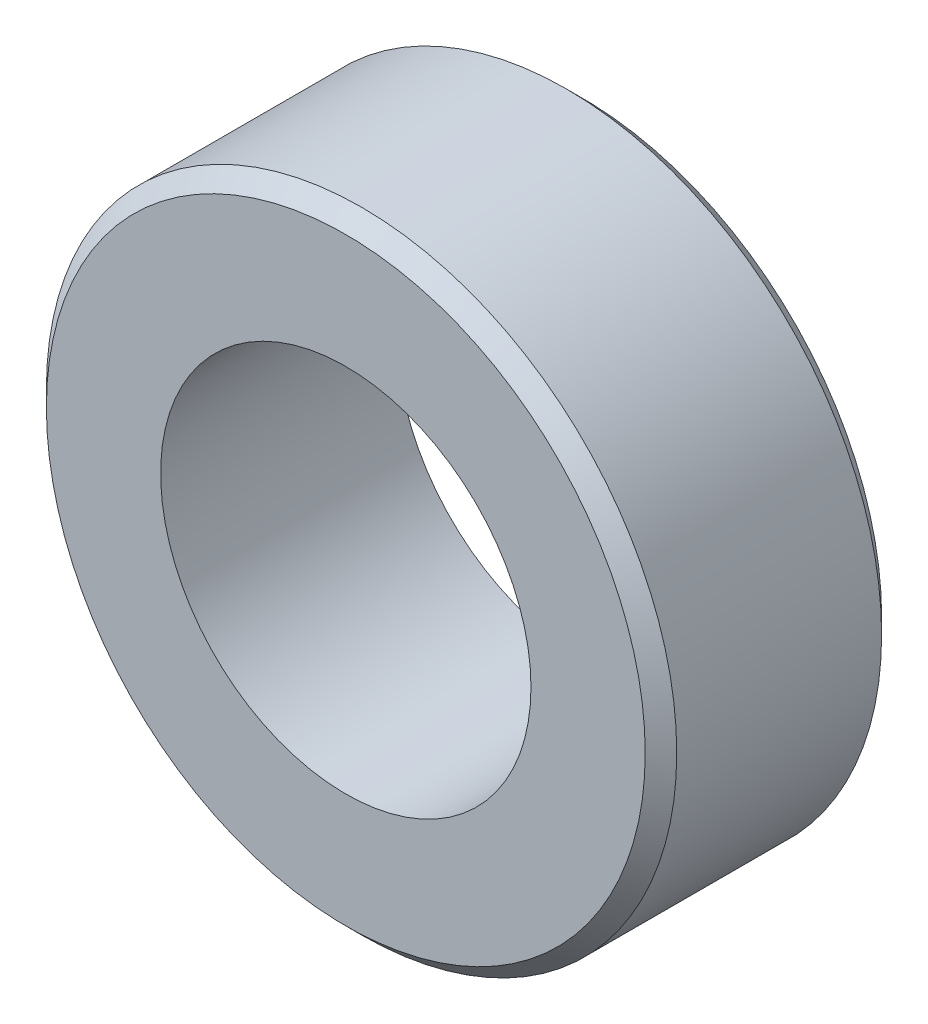
from build123d import *

# Parameters (mm, degrees)
SKETCH2_R           = 40
SKETCH2_R_2         = 23.5
BOSS_EXTRUDE1_DEPTH = 30
CHAMFER1_SIZE       = 2


with BuildPart() as part:
    # Sketch2 → Boss-Extrude1 (new body)
    with BuildSketch(Plane.XY):
        Circle(SKETCH2_R)
        Circle(SKETCH2_R_2, mode=Mode.SUBTRACT)
    extrude(amount=BOSS_EXTRUDE1_DEPTH)

    # Chamfer1
    chamfer1_edges = [part.edges().sort_by_distance(p)[0] for p in [
        (-40, 0, 0),
        (-40, 0, 30),
    ]]
    chamfer(chamfer1_edges, length=CHAMFER1_SIZE)


solid = part.part
